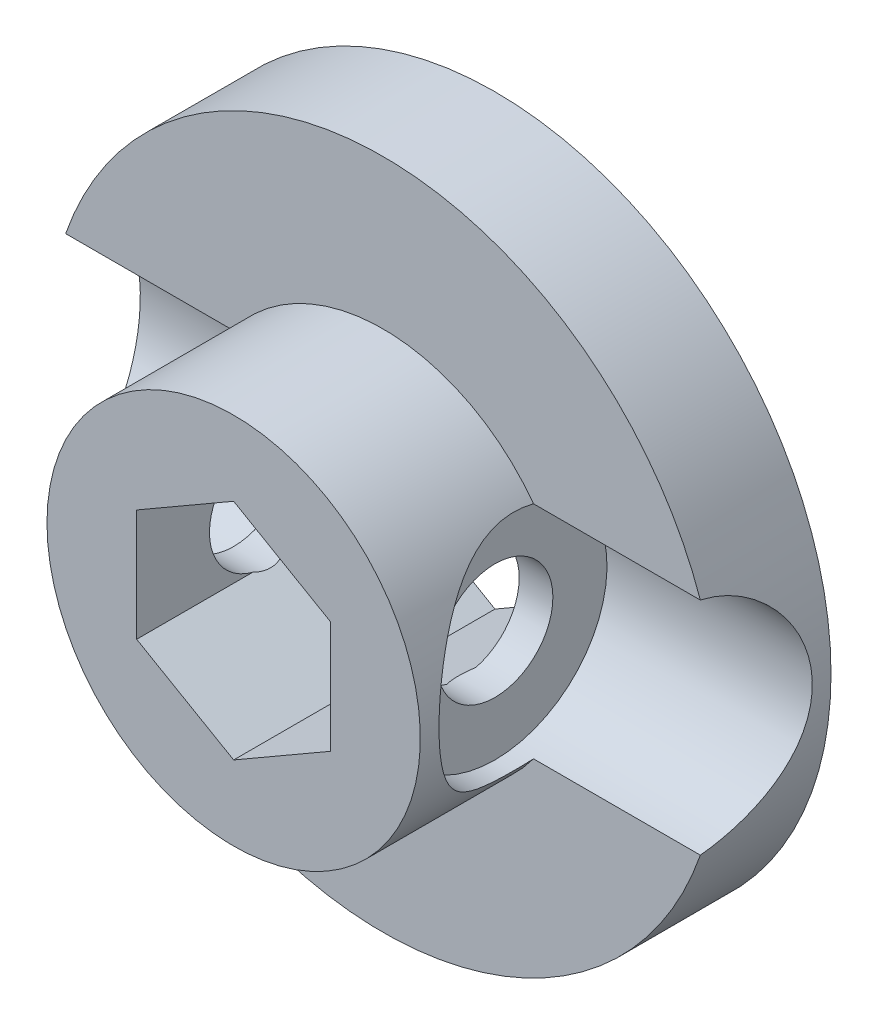
from build123d import *

# Parameters (mm, degrees)
SKETCH1_R               = 9
SKETCH1_R_2             = 5
BOSS_EXTRUDE4_DEPTH     = 3
SKETCH3_R               = 5
BOSS_EXTRUDE5_DEPTH     = 7
CUT_EXTRUDE1_DEPTH      = 5
CUT_EXTRUDE1_DEPTH_BACK = 5
SKETCH5_R               = 1.55
SKETCH6_R               = 3
CUT_EXTRUDE2_DEPTH      = 5.5
CUT_EXTRUDE3_START      = -5.5
SKETCH7_R               = 3
CUT_EXTRUDE3_DEPTH      = 5.5


with BuildPart() as part:
    # Sketch1 → Boss-Extrude4 (new body)
    with BuildSketch(Plane.XY):
        Circle(SKETCH1_R)
        Circle(SKETCH1_R_2, mode=Mode.SUBTRACT)
    extrude(amount=BOSS_EXTRUDE4_DEPTH)

    # Sketch3 → Boss-Extrude5 (add)
    with BuildSketch(Plane(origin=(0, 0, 0), x_dir=(-1, 0, 0), z_dir=(0, 0, -1))):
        Circle(SKETCH3_R)
        Polygon((0, 3), (-2.598076211, 1.5), (-2.598076211, -1.5), (0, -3), (2.598076211, -1.5), (2.598076211, 1.5), align=None, mode=Mode.SUBTRACT)
    extrude(amount=-BOSS_EXTRUDE5_DEPTH)

    # Sketch5 → Cut-Extrude1 (cut, two sides: drawn at the far end of the back side and taken through both)
    with BuildSketch(Plane.ZY.offset(-CUT_EXTRUDE1_DEPTH_BACK)):
        with Locations(Location((3.5, 0, 0), (0, 0, 75.407449398))):
            Circle(SKETCH5_R)
    extrude(amount=CUT_EXTRUDE1_DEPTH + CUT_EXTRUDE1_DEPTH_BACK, mode=Mode.SUBTRACT)

    # Sketch6 → Cut-Extrude2 (cut)
    with BuildSketch(Plane.ZY.offset(3.5)):
        with Locations(Location((3.5, 0, 0), (0, 0, 99.594068227))):
            Circle(SKETCH6_R)
    extrude(amount=CUT_EXTRUDE2_DEPTH, mode=Mode.SUBTRACT)

    # Sketch7 → Cut-Extrude3 (cut)
    with BuildSketch(Plane.ZY.offset(-3.5).offset(CUT_EXTRUDE3_START)):
        with Locations(Location((3.5, 0, 0), (0, 0, 99.594068227))):
            Circle(SKETCH7_R)
    extrude(amount=CUT_EXTRUDE3_DEPTH, mode=Mode.SUBTRACT)


solid = part.part
